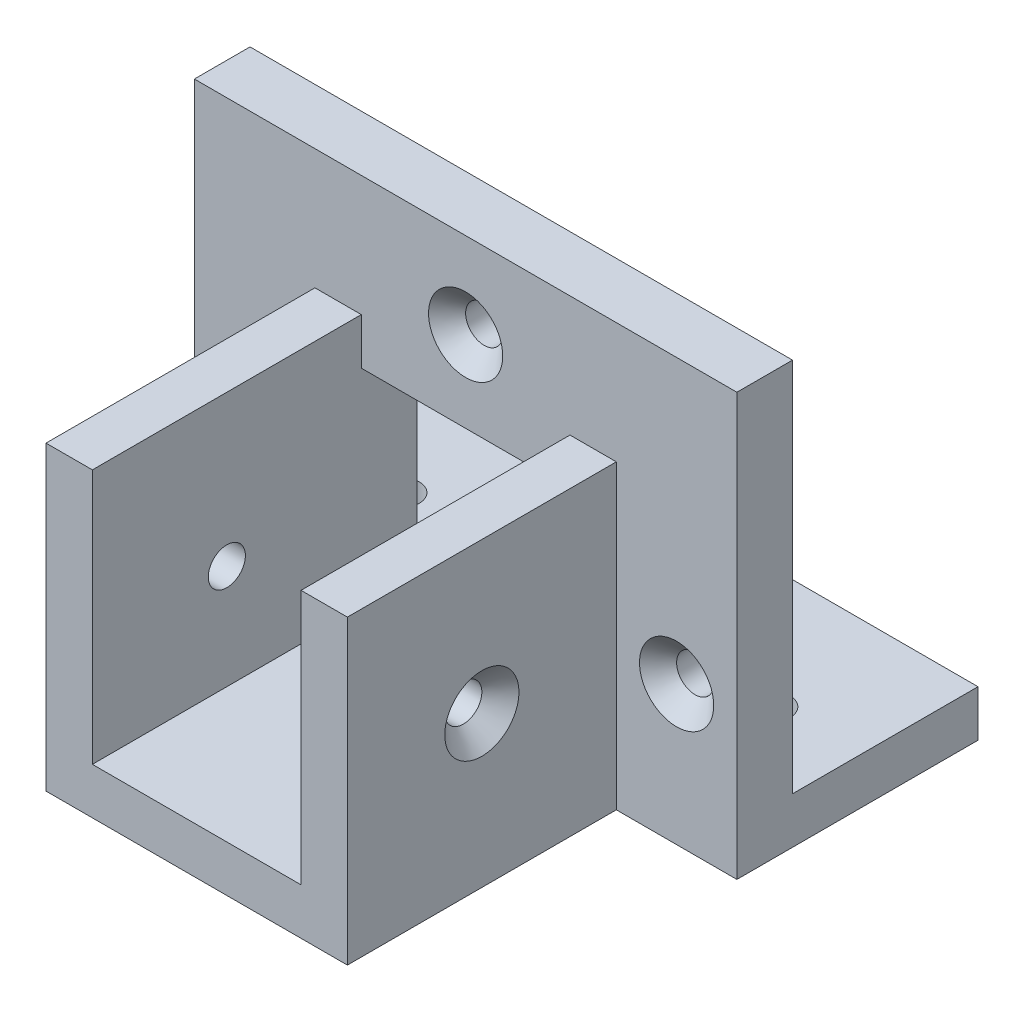
from build123d import *

# Parameters (mm, degrees)
SKETCH1_W           = 32.5
SKETCH1_H           = 32.5
SKETCH1_W_2         = 22.5
SKETCH1_H_2         = 22.5
BOSS_EXTRUDE1_DEPTH = 35
BOSS_EXTRUDE2_DEPTH = 6
SKETCH3_R           = 2
CUT_EXTRUDE1_DEPTH  = 51.518560945
SKETCH4_W           = 22.5
SKETCH4_H           = 5
CUT_EXTRUDE2_DEPTH  = 29
SKETCH6_W           = 58.5
SKETCH6_H           = 5
BOSS_EXTRUDE3_DEPTH = 20
SKETCH5_R           = 2
CUT_EXTRUDE3_DEPTH  = 65.426799548
SKETCH7_R           = 2
CUT_EXTRUDE4_DEPTH  = 65.426799548
CHAMFER1_SIZE       = 2


with BuildPart() as part:
    # Sketch1 → Boss-Extrude1 (new body)
    with BuildSketch(Plane.XY):
        Rectangle(SKETCH1_W, SKETCH1_H)
        Rectangle(SKETCH1_W_2, SKETCH1_H_2, mode=Mode.SUBTRACT)
    extrude(amount=BOSS_EXTRUDE1_DEPTH)

    # Sketch2 → Boss-Extrude2 (add)
    with BuildSketch(Plane(origin=(0, 0, 0), x_dir=(-1, 0, 0), z_dir=(0, 0, -1))):
        Polygon((-16.25, -16.25), (-29.25, -16.25), (-29.25, 29.25), (29.25, 29.25), (29.25, -16.25), (16.25, -16.25), (16.25, 16.25), (-16.25, 16.25), align=None)
    extrude(amount=-BOSS_EXTRUDE2_DEPTH)

    # Sketch3 → Cut-Extrude1 (cut, through all)
    with BuildSketch(Plane.XY.offset(6)):
        with Locations((-22.75, -1.25)):
            Circle(SKETCH3_R)
        with Locations((0, 20)):
            Circle(SKETCH3_R)
        with Locations((22.75, -1.25)):
            Circle(SKETCH3_R)
    extrude(amount=-CUT_EXTRUDE1_DEPTH, mode=Mode.SUBTRACT)

    # Sketch4 → Cut-Extrude2 (cut)
    with BuildSketch(Plane.XY.offset(35)):
        with Locations((0, 13.75)):
            Rectangle(SKETCH4_W, SKETCH4_H)
    extrude(amount=-CUT_EXTRUDE2_DEPTH, mode=Mode.SUBTRACT)

    # Sketch6 → Boss-Extrude3 (add)
    with BuildSketch(Plane(origin=(0, 0, 0), x_dir=(-1, 0, 0), z_dir=(0, 0, -1))):
        with Locations((0, -13.75)):
            Rectangle(SKETCH6_W, SKETCH6_H)
    extrude(amount=BOSS_EXTRUDE3_DEPTH)

    # Sketch5 → Cut-Extrude3 (cut, through all)
    with BuildSketch(Plane(origin=(16.25, 0, 0), x_dir=(0, 0, -1), z_dir=(1, 0, 0))):
        with Locations((-20.5, 0)):
            Circle(SKETCH5_R)
    extrude(amount=-CUT_EXTRUDE3_DEPTH, mode=Mode.SUBTRACT)

    # Sketch7 → Cut-Extrude4 (cut, through all)
    with BuildSketch(Plane.XZ.offset(16.25)):
        with Locations(Location((-20, -7, 0), (0, 0, 270))):
            Circle(SKETCH7_R)
        with Locations(Location((20, -7, 0), (0, 0, 270))):
            Circle(SKETCH7_R)
        with Locations(Location((0, 20.5, 0), (0, 0, 270))):
            Circle(SKETCH7_R)
    extrude(amount=-CUT_EXTRUDE4_DEPTH, mode=Mode.SUBTRACT)

    # Chamfer1
    chamfer1_edges = [part.edges().sort_by_distance(p)[0] for p in [
        (-20, -16.25, -5),
        (20, -16.25, -5),
        (0, -16.25, 22.5),
        (-24.75, -1.25, 6),
        (-2, 20, 6),
        (20.75, -1.25, 6),
        (-16.25, 0, 22.5),
        (16.25, 0, 22.5),
    ]]
    chamfer(chamfer1_edges, length=CHAMFER1_SIZE)


solid = part.part
